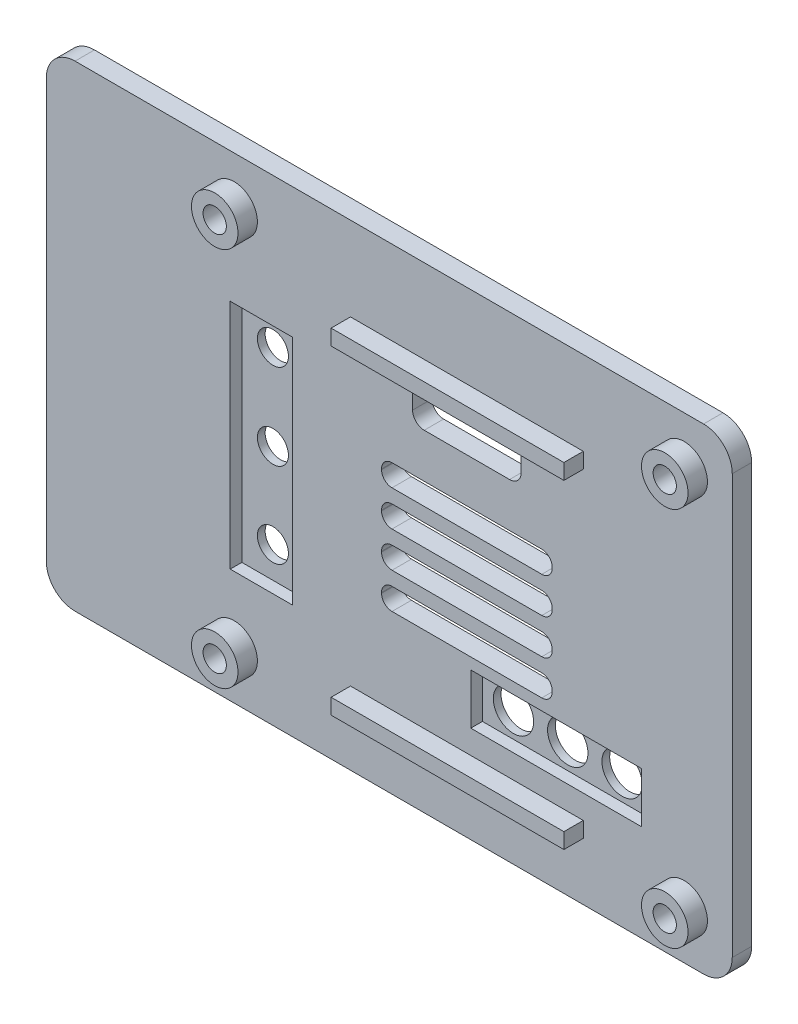
from build123d import *

# Parameters (mm, degrees)
EXTRUDE_1_DEPTH      = 2
SKETCH_2_R           = 1.5
CUT_EXTRUDE_1_DEPTH  = 55.260206413
EXTRUDE_START        = -2
EXTRUDE_2_DEPTH      = 2
SKETCH_4_R           = 2
SKETCH_4_R_2         = 2.6
CUT_EXTRUDE_2_DEPTH  = 56.093103017
CUT_EXTRUDE_5_DEPTH  = 56.093103017
SKETCH_6_W           = 8
SKETCH_6_H           = 30
SKETCH_6_W_2         = 22
SKETCH_6_H_2         = 6.5
CUT_EXTRUDE_6_DEPTH  = 1
SKETCH_11_R          = 1.5
SKETCH_11_W          = 8
SKETCH_11_H          = 29.9
SKETCH_11_W_2        = 22
SKETCH_11_H_2        = 6.5
EXTRUDE_4_DEPTH      = 0.5
CUT_EXTRUDE_START    = -3
CUT_EXTRUDE_8_DEPTH  = 3
SKETCH_13_R          = 3
SKETCH_13_R_2        = 1.5
EXTRUDE_5_DEPTH      = 2.5
SKETCH_14_R          = 2.5
CUT_EXTRUDE_9_DEPTH  = 2
SKETCH_15_W          = 30
SKETCH_15_H          = 2
EXTRUDE_7_DEPTH      = 2.5
EXTRUDE_8_DEPTH      = 2.5
CUT_EXTRUDE_10_DEPTH = 2.5
CUT_EXTRUDE_11_DEPTH = 10


with BuildPart() as part:
    # 스케치1 → 보스-돌출1 (new body)
    with BuildSketch(Plane.XY):
        with BuildLine():
            Line((44.9, -27), (44.9, 27))
            ThreePointArc((44.9, 27), (43.904163056, 29.404163056), (41.5, 30.4))
            Line((41.5, 30.4), (-39.5, 30.4))
            ThreePointArc((-39.5, 30.4), (-41.904163056, 29.404163056), (-42.9, 27))
            Line((-42.9, 27), (-42.9, -27))
            ThreePointArc((-42.9, -27), (-41.904163056, -29.404163056), (-39.5, -30.4))
            Line((-39.5, -30.4), (41.5, -30.4))
            ThreePointArc((41.5, -30.4), (43.904163056, -29.404163056), (44.9, -27))
        make_face()
    extrude(amount=EXTRUDE_1_DEPTH)

    # 스케치2 → 컷-돌출1 (cut, through all)
    with BuildSketch(Plane.XY.offset(2)):
        with Locations((39, 24.5)):
            Circle(SKETCH_2_R)
        with Locations((-19, -24.5)):
            Circle(SKETCH_2_R)
        with Locations((-19, 24.5)):
            Circle(SKETCH_2_R)
        with Locations((39, -24.5)):
            Circle(SKETCH_2_R)
    extrude(amount=-CUT_EXTRUDE_1_DEPTH, mode=Mode.SUBTRACT)

    # 스케치3 → 보스-돌출2 (add)
    with BuildSketch(Plane.XY.offset(2).offset(EXTRUDE_START)):
        with BuildLine():
            Line((45.5, -27), (45.5, 27))
            ThreePointArc((45.5, 27), (44.328427125, 29.828427125), (41.5, 31))
            Line((41.5, 31), (-39.5, 31))
            ThreePointArc((-39.5, 31), (-42.328427125, 29.828427125), (-43.5, 27))
            Line((-43.5, 27), (-43.5, -27))
            ThreePointArc((-43.5, -27), (-42.328427125, -29.828427125), (-39.5, -31))
            Line((-39.5, -31), (41.5, -31))
            ThreePointArc((41.5, -31), (44.328427125, -29.828427125), (45.5, -27))
        make_face()
        with BuildLine():
            Line((44.9, -27), (44.9, 27))
            ThreePointArc((44.9, 27), (43.904163056, 29.404163056), (41.5, 30.4))
            Line((41.5, 30.4), (-39.5, 30.4))
            ThreePointArc((-39.5, 30.4), (-41.904163056, 29.404163056), (-42.9, 27))
            Line((-42.9, 27), (-42.9, -27))
            ThreePointArc((-42.9, -27), (-41.904163056, -29.404163056), (-39.5, -30.4))
            Line((-39.5, -30.4), (41.5, -30.4))
            ThreePointArc((41.5, -30.4), (43.904163056, -29.404163056), (44.9, -27))
        make_face(mode=Mode.SUBTRACT)
    extrude(amount=EXTRUDE_2_DEPTH)

    # 스케치4 → 컷-돌출2 (cut, through all)
    with BuildSketch(Plane(origin=(0, 0, 0), x_dir=(-1, 0, 0), z_dir=(0, 0, -1))):
        with Locations((15.5, 10)):
            Circle(SKETCH_4_R)
        with Locations((15.5, -1.05)):
            Circle(SKETCH_4_R)
        with Locations((15.5, -12)):
            Circle(SKETCH_4_R)
        with Locations((-15.5, -15)):
            Circle(SKETCH_4_R_2)
        with Locations((-29.5, -15)):
            Circle(SKETCH_4_R_2)
        with Locations((-22.5, -15)):
            Circle(SKETCH_4_R_2)
    extrude(amount=-CUT_EXTRUDE_2_DEPTH, mode=Mode.SUBTRACT)

    # 스케치5 → 컷-돌출5 (cut, through all)
    with BuildSketch(Plane(origin=(0, 0, 0), x_dir=(-1, 0, 0), z_dir=(0, 0, -1))):
        with BuildLine():
            Line((0, -8.95), (0, -8.85))
            ThreePointArc((0, -8.85), (-0.395405845, -7.895405845), (-1.35, -7.5))
            Line((-1.35, -7.5), (-20.65, -7.5))
            ThreePointArc((-20.65, -7.5), (-21.604594155, -7.895405845), (-22, -8.85))
            Line((-22, -8.85), (-22, -8.95))
            ThreePointArc((-22, -8.95), (-21.604594155, -9.904594155), (-20.65, -10.3))
            Line((-20.65, -10.3), (-1.35, -10.3))
            ThreePointArc((-1.35, -10.3), (-0.395405845, -9.904594155), (0, -8.95))
        make_face()
        with BuildLine():
            Line((-1.35, -5.7), (-20.65, -5.7))
            ThreePointArc((-20.65, -5.7), (-21.604594155, -5.304594155), (-22, -4.35))
            Line((-22, -4.35), (-22, -4.25))
            ThreePointArc((-22, -4.25), (-21.604594155, -3.295405845), (-20.65, -2.9))
            Line((-20.65, -2.9), (-1.35, -2.9))
            ThreePointArc((-1.35, -2.9), (-0.395405845, -3.295405845), (0, -4.25))
            Line((0, -4.25), (0, -4.35))
            ThreePointArc((0, -4.35), (-0.395405845, -5.304594155), (-1.35, -5.7))
        make_face()
        with BuildLine():
            Line((0, 0.25), (0, 0.35))
            ThreePointArc((0, 0.35), (-0.395405845, 1.304594155), (-1.35, 1.7))
            Line((-1.35, 1.7), (-20.65, 1.7))
            ThreePointArc((-20.65, 1.7), (-21.604594155, 1.304594155), (-22, 0.35))
            Line((-22, 0.35), (-22, 0.25))
            ThreePointArc((-22, 0.25), (-21.604594155, -0.704594155), (-20.65, -1.1))
            Line((-20.65, -1.1), (-1.35, -1.1))
            ThreePointArc((-1.35, -1.1), (-0.395405845, -0.704594155), (0, 0.25))
        make_face()
        with BuildLine():
            Line((0, 4.85), (0, 4.95))
            ThreePointArc((0, 4.95), (-0.395405845, 5.904594155), (-1.35, 6.3))
            Line((-1.35, 6.3), (-20.65, 6.3))
            ThreePointArc((-20.65, 6.3), (-21.604594155, 5.904594155), (-22, 4.95))
            Line((-22, 4.95), (-22, 4.85))
            ThreePointArc((-22, 4.85), (-21.604594155, 3.895405845), (-20.65, 3.5))
            Line((-20.65, 3.5), (-1.35, 3.5))
            ThreePointArc((-1.35, 3.5), (-0.395405845, 3.895405845), (0, 4.85))
        make_face()
        with BuildLine():
            Line((0, 9.45), (0, 9.55))
            ThreePointArc((0, 9.55), (-0.395405845, 10.504594155), (-1.35, 10.9))
            Line((-1.35, 10.9), (-20.65, 10.9))
            ThreePointArc((-20.65, 10.9), (-21.604594155, 10.504594155), (-22, 9.55))
            Line((-22, 9.55), (-22, 9.45))
            ThreePointArc((-22, 9.45), (-21.604594155, 8.495405845), (-20.65, 8.1))
            Line((-20.65, 8.1), (-1.35, 8.1))
            ThreePointArc((-1.35, 8.1), (-0.395405845, 8.495405845), (0, 9.45))
        make_face()
    extrude(amount=-CUT_EXTRUDE_5_DEPTH, mode=Mode.SUBTRACT)

    # 스케치6 → 컷-돌출6 (cut)
    with BuildSketch(Plane.XY.offset(2)):
        with Locations((-15.5, -1)):
            Rectangle(SKETCH_6_W, SKETCH_6_H)
        with Locations((22.5, -15)):
            Rectangle(SKETCH_6_W_2, SKETCH_6_H_2)
    extrude(amount=-CUT_EXTRUDE_6_DEPTH, mode=Mode.SUBTRACT)

    # 스케치11 → 보스-돌출4 (add)
    with BuildSketch(Plane.XY.offset(2)):
        with BuildLine():
            ThreePointArc((41.5, -31), (44.328427125, -29.828427125), (45.5, -27))
            Line((45.5, -27), (45.5, 27))
            ThreePointArc((45.5, 27), (44.328427125, 29.828427125), (41.5, 31))
            Line((41.5, 31), (-39.5, 31))
            ThreePointArc((-39.5, 31), (-42.328427125, 29.828427125), (-43.5, 27))
            Line((-43.5, 27), (-43.5, -27))
            ThreePointArc((-43.5, -27), (-42.328427125, -29.828427125), (-39.5, -31))
            Line((-39.5, -31), (41.5, -31))
        make_face()
        with Locations((-19, -24.5)):
            Circle(SKETCH_11_R, mode=Mode.SUBTRACT)
        with Locations((-15.5, -1.05)):
            Rectangle(SKETCH_11_W, SKETCH_11_H, mode=Mode.SUBTRACT)
        with Locations((39, -24.5)):
            Circle(SKETCH_11_R, mode=Mode.SUBTRACT)
        with BuildLine():
            ThreePointArc((22, -8.95), (21.604594155, -9.904594155), (20.65, -10.3))
            Line((20.65, -10.3), (1.35, -10.3))
            ThreePointArc((1.35, -10.3), (0.395405845, -9.904594155), (0, -8.95))
            Line((0, -8.95), (0, -8.85))
            ThreePointArc((0, -8.85), (0.395405845, -7.895405845), (1.35, -7.5))
            Line((1.35, -7.5), (20.65, -7.5))
            ThreePointArc((20.65, -7.5), (21.604594155, -7.895405845), (22, -8.85))
            Line((22, -8.85), (22, -8.95))
        make_face(mode=Mode.SUBTRACT)
        with Locations((22.5, -15)):
            Rectangle(SKETCH_11_W_2, SKETCH_11_H_2, mode=Mode.SUBTRACT)
        with BuildLine():
            Line((22, -4.25), (22, -4.35))
            ThreePointArc((22, -4.35), (21.604594155, -5.304594155), (20.65, -5.7))
            Line((20.65, -5.7), (1.35, -5.7))
            ThreePointArc((1.35, -5.7), (0.395405845, -5.304594155), (0, -4.35))
            Line((0, -4.35), (0, -4.25))
            ThreePointArc((0, -4.25), (0.395405845, -3.295405845), (1.35, -2.9))
            Line((1.35, -2.9), (20.65, -2.9))
            ThreePointArc((20.65, -2.9), (21.604594155, -3.295405845), (22, -4.25))
        make_face(mode=Mode.SUBTRACT)
        with Locations((-19, 24.5)):
            Circle(SKETCH_11_R, mode=Mode.SUBTRACT)
        with BuildLine():
            Line((22, 0.35), (22, 0.25))
            ThreePointArc((22, 0.25), (21.604594155, -0.704594155), (20.65, -1.1))
            Line((20.65, -1.1), (1.35, -1.1))
            ThreePointArc((1.35, -1.1), (0.395405845, -0.704594155), (0, 0.25))
            Line((0, 0.25), (0, 0.35))
            ThreePointArc((0, 0.35), (0.395405845, 1.304594155), (1.35, 1.7))
            Line((1.35, 1.7), (20.65, 1.7))
            ThreePointArc((20.65, 1.7), (21.604594155, 1.304594155), (22, 0.35))
        make_face(mode=Mode.SUBTRACT)
        with BuildLine():
            Line((22, 4.95), (22, 4.85))
            ThreePointArc((22, 4.85), (21.604594155, 3.895405845), (20.65, 3.5))
            Line((20.65, 3.5), (1.35, 3.5))
            ThreePointArc((1.35, 3.5), (0.395405845, 3.895405845), (0, 4.85))
            Line((0, 4.85), (0, 4.95))
            ThreePointArc((0, 4.95), (0.395405845, 5.904594155), (1.35, 6.3))
            Line((1.35, 6.3), (20.65, 6.3))
            ThreePointArc((20.65, 6.3), (21.604594155, 5.904594155), (22, 4.95))
        make_face(mode=Mode.SUBTRACT)
        with BuildLine():
            Line((22, 9.55), (22, 9.45))
            ThreePointArc((22, 9.45), (21.604594155, 8.495405845), (20.65, 8.1))
            Line((20.65, 8.1), (1.35, 8.1))
            ThreePointArc((1.35, 8.1), (0.395405845, 8.495405845), (0, 9.45))
            Line((0, 9.45), (0, 9.55))
            ThreePointArc((0, 9.55), (0.395405845, 10.504594155), (1.35, 10.9))
            Line((1.35, 10.9), (20.65, 10.9))
            ThreePointArc((20.65, 10.9), (21.604594155, 10.504594155), (22, 9.55))
        make_face(mode=Mode.SUBTRACT)
        with Locations((39, 24.5)):
            Circle(SKETCH_11_R, mode=Mode.SUBTRACT)
    extrude(amount=EXTRUDE_4_DEPTH)

    # 스케치12 → 컷-돌출8 (cut)
    with BuildSketch(Plane.XY.offset(2.5).offset(CUT_EXTRUDE_START)):
        with BuildLine():
            Line((-43.5, 27), (-43.5, -27))
            ThreePointArc((-43.5, -27), (-42.328427125, -29.828427125), (-39.5, -31))
            Line((-39.5, -31), (41.5, -31))
            ThreePointArc((41.5, -31), (44.328427125, -29.828427125), (45.5, -27))
            Line((45.5, -27), (45.5, 27))
            ThreePointArc((45.5, 27), (44.328427125, 29.828427125), (41.5, 31))
            Line((41.5, 31), (-39.5, 31))
            ThreePointArc((-39.5, 31), (-42.328427125, 29.828427125), (-43.5, 27))
        make_face()
        with BuildLine():
            Line((-43.2, 27), (-43.2, -27))
            ThreePointArc((-43.2, -27), (-42.11629509, -29.61629509), (-39.5, -30.7))
            Line((-39.5, -30.7), (41.5, -30.7))
            ThreePointArc((41.5, -30.7), (44.11629509, -29.61629509), (45.2, -27))
            Line((45.2, -27), (45.2, 27))
            ThreePointArc((45.2, 27), (44.11629509, 29.61629509), (41.5, 30.7))
            Line((41.5, 30.7), (-39.5, 30.7))
            ThreePointArc((-39.5, 30.7), (-42.11629509, 29.61629509), (-43.2, 27))
        make_face(mode=Mode.SUBTRACT)
    extrude(amount=CUT_EXTRUDE_8_DEPTH, mode=Mode.SUBTRACT)

    # 스케치13 → 보스-돌출5 (add)
    # profile 1 of 4: a face of its own
    with BuildSketch(Plane.XY.offset(2.5)):
        with Locations((-19, 24.5)):
            Circle(SKETCH_13_R)
        with Locations((-19, 24.5)):
            Circle(SKETCH_13_R_2, mode=Mode.SUBTRACT)
    # profile 2 of 4: a face of its own
    with BuildSketch(Plane.XY.offset(2.5)):
        with Locations((39, 24.5)):
            Circle(SKETCH_13_R)
        with Locations((39, 24.5)):
            Circle(SKETCH_13_R_2, mode=Mode.SUBTRACT)
    # profile 3 of 4: a face of its own
    with BuildSketch(Plane.XY.offset(2.5)):
        with Locations((39, -24.5)):
            Circle(SKETCH_13_R)
        with Locations((39, -24.5)):
            Circle(SKETCH_13_R_2, mode=Mode.SUBTRACT)
    # profile 4 of 4: a face of its own
    with BuildSketch(Plane.XY.offset(2.5)):
        with Locations((-19, -24.5)):
            Circle(SKETCH_13_R)
        with Locations((-19, -24.5)):
            Circle(SKETCH_13_R_2, mode=Mode.SUBTRACT)
    extrude(amount=EXTRUDE_5_DEPTH)

    # 스케치14 → 컷-돌출9 (cut)
    with BuildSketch(Plane(origin=(0, 0, 0), x_dir=(-1, 0, 0), z_dir=(0, 0, -1))):
        with Locations((-39, 24.5)):
            Circle(SKETCH_14_R)
        with Locations((19, 24.5)):
            Circle(SKETCH_14_R)
        with Locations((19, -24.5)):
            Circle(SKETCH_14_R)
        with Locations((-39, -24.5)):
            Circle(SKETCH_14_R)
    extrude(amount=-CUT_EXTRUDE_9_DEPTH, mode=Mode.SUBTRACT)

    # 스케치15 → 보스-돌출7 (add)
    with BuildSketch(Plane.XY.offset(2.5)):
        with Locations((11, 18.9)):
            Rectangle(SKETCH_15_W, SKETCH_15_H)
        with Locations((11, -22.3)):
            Rectangle(SKETCH_15_W, SKETCH_15_H)
    extrude(amount=EXTRUDE_7_DEPTH)

    # 스케치16 → 보스-돌출8 (add)
    with BuildSketch(Plane(origin=(0, 0, 0), x_dir=(-1, 0, 0), z_dir=(0, 0, -1))):
        with BuildLine():
            Line((-1.35, 8.1), (-20.65, 8.1))
            ThreePointArc((-20.65, 8.1), (-21.604594155, 8.495405845), (-22, 9.45))
            Line((-22, 9.45), (-22, 9.55))
            ThreePointArc((-22, 9.55), (-21.604594155, 10.504594155), (-20.65, 10.9))
            Line((-20.65, 10.9), (-1.35, 10.9))
            ThreePointArc((-1.35, 10.9), (-0.395405845, 10.504594155), (0, 9.55))
            Line((0, 9.55), (0, 9.45))
            ThreePointArc((0, 9.45), (-0.395405845, 8.495405845), (-1.35, 8.1))
        make_face()
    extrude(amount=-EXTRUDE_8_DEPTH)

    # 스케치17 → 컷-돌출10 (cut)
    with BuildSketch(Plane(origin=(0, 0, 0), x_dir=(-1, 0, 0), z_dir=(0, 0, -1))):
        with BuildLine():
            Line((-5.85, 17), (-16.15, 17))
            ThreePointArc((-16.15, 17), (-17.104594155, 16.604594155), (-17.5, 15.65))
            Line((-17.5, 15.65), (-17.5, 13.85))
            ThreePointArc((-17.5, 13.85), (-17.104594155, 12.895405845), (-16.15, 12.5))
            Line((-16.15, 12.5), (-5.85, 12.5))
            ThreePointArc((-5.85, 12.5), (-4.895405845, 12.895405845), (-4.5, 13.85))
            Line((-4.5, 13.85), (-4.5, 15.65))
            ThreePointArc((-4.5, 15.65), (-4.895405845, 16.604594155), (-5.85, 17))
        make_face()
    extrude(amount=-CUT_EXTRUDE_10_DEPTH, mode=Mode.SUBTRACT)

    # 스케치18 → 컷-돌출11 (cut)
    with BuildSketch(Plane(origin=(0, 0, 0), x_dir=(-1, 0, 0), z_dir=(0, 0, -1))):
        with BuildLine():
            Line((-16.5, 17), (-5.5, 17))
            ThreePointArc((-5.5, 17), (-4.439339828, 16.560660172), (-4, 15.5))
            Line((-4, 15.5), (-4, 13.5))
            ThreePointArc((-4, 13.5), (-4.439339828, 12.439339828), (-5.5, 12))
            Line((-5.5, 12), (-16.5, 12))
            ThreePointArc((-16.5, 12), (-17.560660172, 12.439339828), (-18, 13.5))
            Line((-18, 13.5), (-18, 15.5))
            ThreePointArc((-18, 15.5), (-17.560660172, 16.560660172), (-16.5, 17))
        make_face()
    extrude(amount=-CUT_EXTRUDE_11_DEPTH, mode=Mode.SUBTRACT)


solid = part.part
